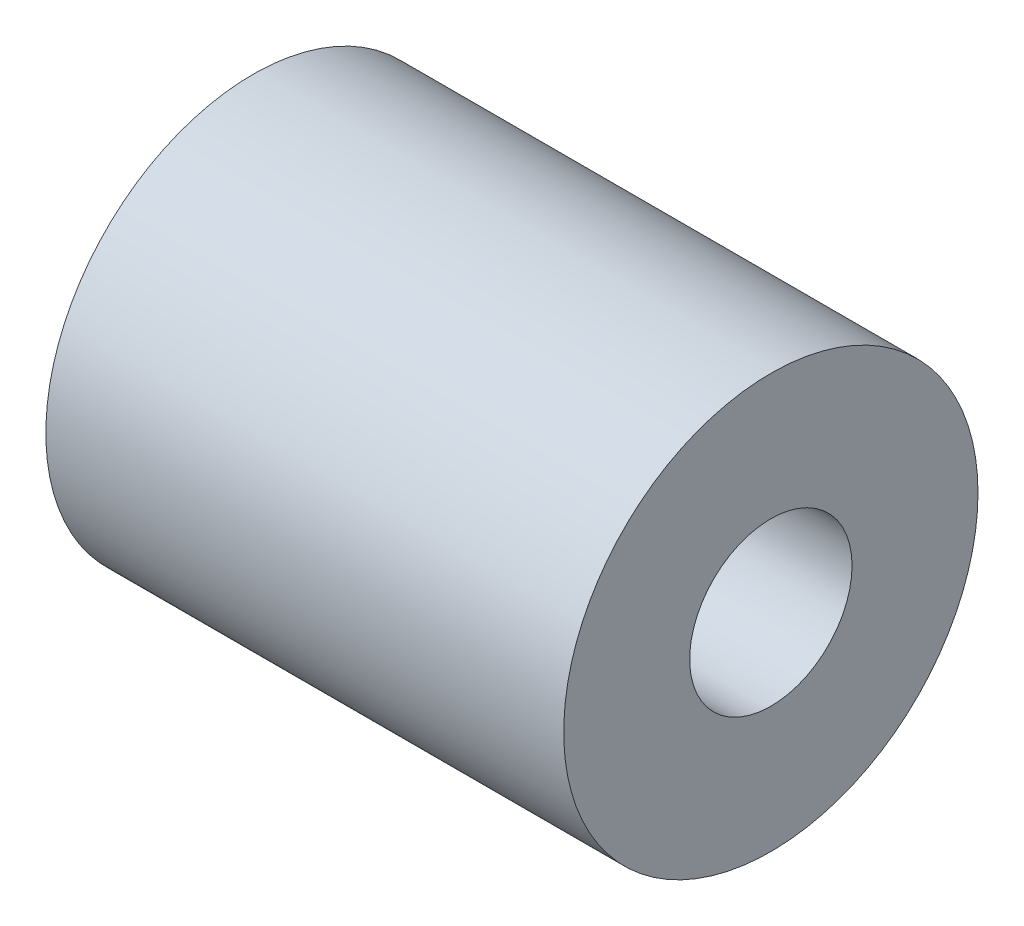
from build123d import *

# Parameters (mm, degrees)
SKETCH1_R           = 6.35
SKETCH1_R_2         = 2.4892
BOSS_EXTRUDE1_DEPTH = 15.875


with BuildPart() as part:
    # Sketch1 → Boss-Extrude1 (new body)
    with BuildSketch(Plane(origin=(0, 0, 0), x_dir=(0, 0, -1), z_dir=(1, 0, 0))):
        Circle(SKETCH1_R)
        Circle(SKETCH1_R_2, mode=Mode.SUBTRACT)
    extrude(amount=BOSS_EXTRUDE1_DEPTH)


solid = part.part
